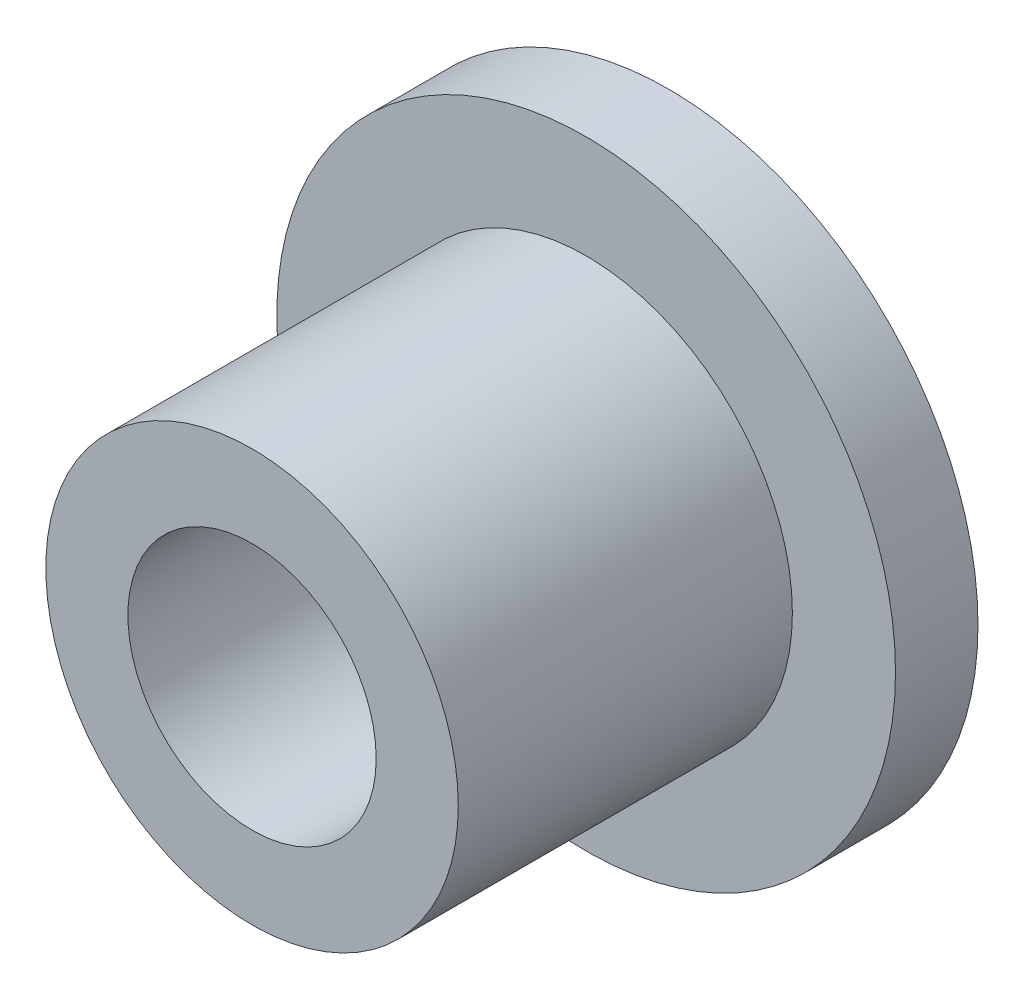
from build123d import *

# Parameters (mm, degrees)
S01_STEEL_LOAD_SPREADING_FLANGE_R             = 7.5
S01_STEEL_LOAD_SPREADING_FLANGE_R_2           = 3.01
F_01_STEEL_LOAD_SPREADING_FLANGE_DEPTH        = 2
F_02_START                                    = 2
S02_STUD_BEARING_SEAT_AND_CRUSH_SLEEVE_R      = 5
S02_STUD_BEARING_SEAT_AND_CRUSH_SLEEVE_R_2    = 3.01
F_02_STUD_BEARING_SEAT_AND_CRUSH_SLEEVE_DEPTH = 8.1


with BuildPart() as part:
    # S01 - Steel load spreading flange → 01 - Steel load spreading flange (new body)
    with BuildSketch(Plane.XY):
        Circle(S01_STEEL_LOAD_SPREADING_FLANGE_R)
        Circle(S01_STEEL_LOAD_SPREADING_FLANGE_R_2, mode=Mode.SUBTRACT)
    extrude(amount=F_01_STEEL_LOAD_SPREADING_FLANGE_DEPTH)

    # S02 - Stud bearing seat and crush sleeve → 02 - Stud bearing seat and crush sleeve (add)
    with BuildSketch(Plane.XY.offset(F_02_START)):
        Circle(S02_STUD_BEARING_SEAT_AND_CRUSH_SLEEVE_R)
        Circle(S02_STUD_BEARING_SEAT_AND_CRUSH_SLEEVE_R_2, mode=Mode.SUBTRACT)
    extrude(amount=F_02_STUD_BEARING_SEAT_AND_CRUSH_SLEEVE_DEPTH)


solid = part.part
